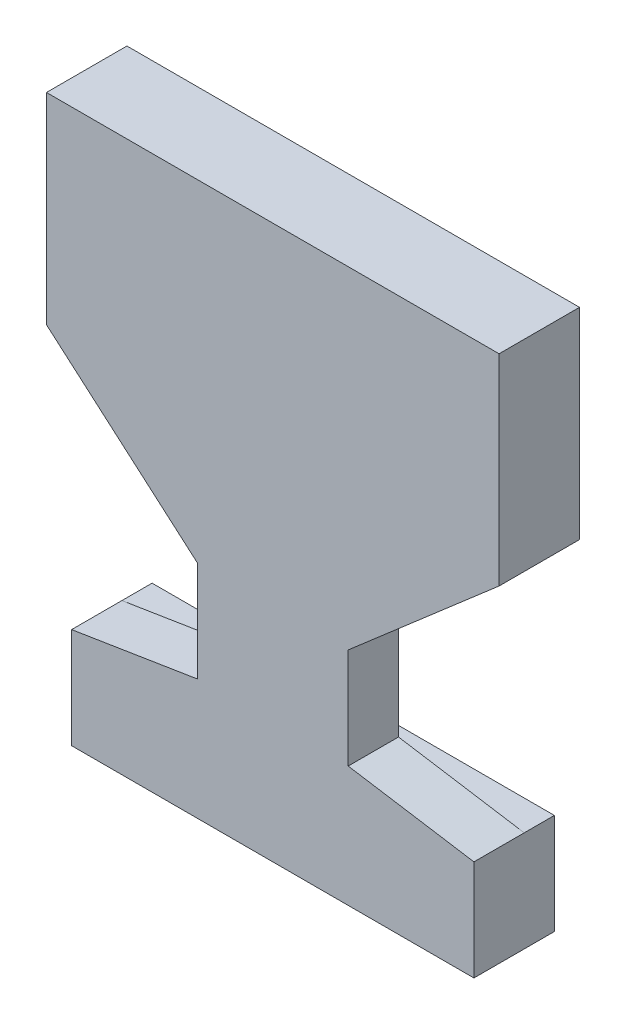
from build123d import *

# Parameters (mm, degrees)
EXTRUDE_1_DEPTH     = 8
CUT_EXTRUDE_1_DEPTH = 3


with BuildPart() as part:
    # Эскиз2 → Бобышка-Вытянуть1 (new body)
    with BuildSketch(Plane.XY):
        Polygon((0, 0), (40, 0), (40, 10), (27.5, 12), (27.5, 22), (42.5, 35), (42.5, 55), (-2.5, 55), (-2.5, 35), (12.5, 22), (12.5, 12), (0, 10), align=None)
    extrude(amount=EXTRUDE_1_DEPTH)

    # Эскиз3 → Вырез-Вытянуть1 (cut)
    with BuildSketch(Plane(origin=(0, 0, 0), x_dir=(-1, 0, 0), z_dir=(0, 0, -1))):
        Polygon((-40, 10), (-27.5, 12), (-27.5, 22), (-42.5, 35), (2.5, 35), (-12.5, 22), (-12.5, 12), (0, 10), align=None)
    extrude(amount=-CUT_EXTRUDE_1_DEPTH, mode=Mode.SUBTRACT)


solid = part.part
